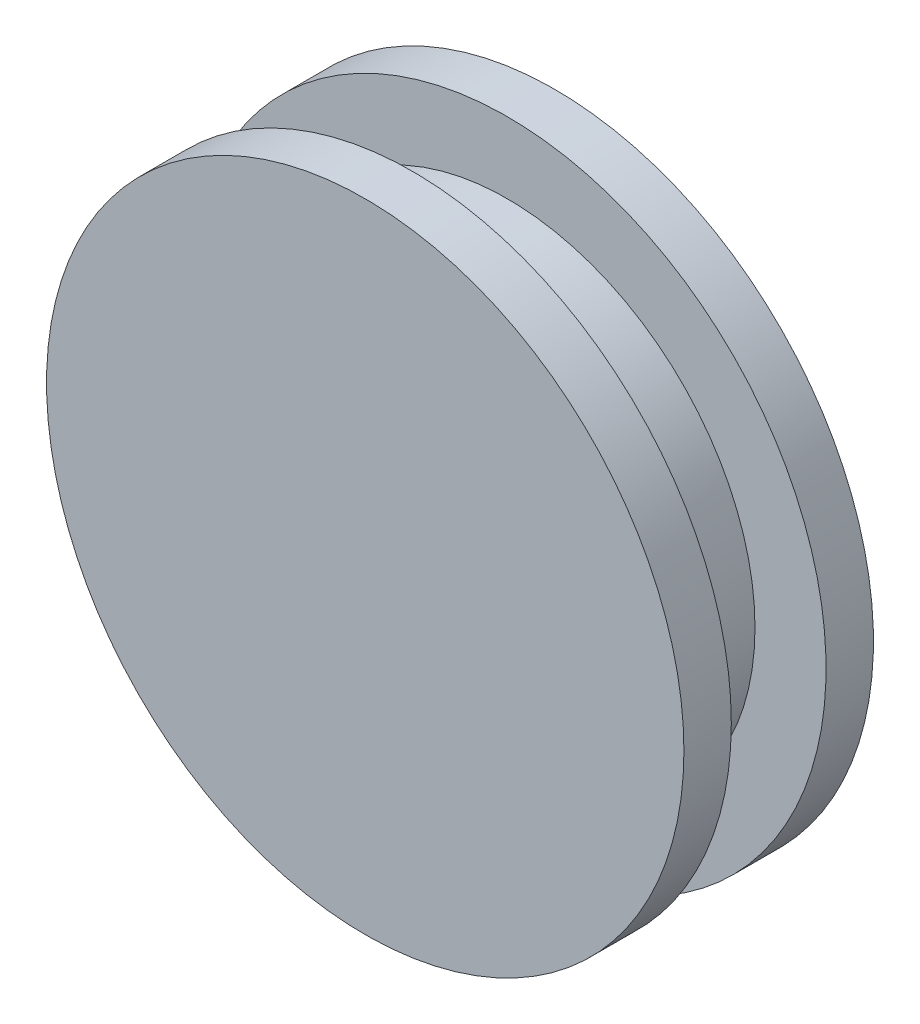
from build123d import *

# Parameters (mm, degrees)
SKETCH_1_R               = 5.226152672
SKETCH_1_R_2             = 4.375
EXTRUDE_1_DEPTH          = 4
EXTRUDE_2_DEPTH          = 4
PATTERN_CIRCULAR_1_COUNT = 15
SKETCH_6_R               = 6.726152672
EXTRUDE_3_DEPTH          = 1
EXTRUDE_START            = -1
SKETCH_7_R               = 6.726152672
EXTRUDE_4_DEPTH          = 1


with BuildPart() as part:
    # 草图1 → 凸台-拉伸1 (new body)
    with BuildSketch(Plane.XY):
        Circle(SKETCH_1_R)
        Circle(SKETCH_1_R_2, mode=Mode.SUBTRACT)
    extrude(amount=EXTRUDE_1_DEPTH)

    # 草图2 → 凸台-拉伸2 (add)
    with BuildSketch(Plane.XY):
        with BuildLine():
            ThreePointArc((0.31607031, 3.509643792), (0, 3.523847328), (-0.31607031, 3.509643792))
            add(Edge.make_bspline(
                [(-0.31607031, 3.509643792), (-0.317489514, 3.521081143), (-0.320420158, 3.535834937), (-0.324949459, 3.554314244), (-0.328034749, 3.565891921), (-0.331739755, 3.57876045), (-0.336117859, 3.59289901), (-0.341220963, 3.608285328), (-0.347100611, 3.624895512), (-0.353807588, 3.64270413), (-0.361391986, 3.661684207), (-0.369903132, 3.681807247), (-0.379389557, 3.703043255), (-0.389898951, 3.725360758), (-0.401478123, 3.748726822), (-0.414172969, 3.773107082), (-0.428028422, 3.79846576), (-0.443088427, 3.82476569), (-0.459395891, 3.851968348), (-0.476992655, 3.880033875), (-0.495919456, 3.908921106), (-0.516215888, 3.938587597), (-0.537920373, 3.968989654), (-0.561070121, 4.000082368), (-0.585701102, 4.031819639), (-0.61184801, 4.064154213), (-0.639544234, 4.097037714), (-0.668821825, 4.130420675), (-0.699711465, 4.164252574), (-0.732242442, 4.19848187), (-0.766442618, 4.233056038), (-0.802338402, 4.267921604), (-0.839954725, 4.303024185), (-0.879315006, 4.338308526), (-0.934862039, 4.38613503), (-0.978147055, 4.421171995), (-1.007818143, 4.444246795)],
                knots=[0, 0, 0, 0, 0.029141347, 0.03806468, 0.048177792, 0.05948068, 0.071973347, 0.085655791, 0.100528014, 0.116590013, 0.133841791, 0.152283346, 0.171914679, 0.19273579, 0.214746679, 0.237947345, 0.262337789, 0.287918011, 0.314688011, 0.342647788, 0.371797343, 0.402136676, 0.433665787, 0.466384675, 0.500293341, 0.535391785, 0.571680007, 0.609158006, 0.647825783, 0.687683338, 0.728730671, 0.770967781, 0.81439467, 0.859011336, 0.904817779, 1, 1, 1, 1], degree=3))
            ThreePointArc((-1.007818143, 4.444246795), (0, 4.557085361), (1.007818143, 4.444246795))
            add(Edge.make_bspline(
                [(0.31607031, 3.509643792), (0.317489514, 3.521081143), (0.320420158, 3.535834937), (0.324949459, 3.554314244), (0.328034749, 3.565891921), (0.331739755, 3.57876045), (0.336117859, 3.59289901), (0.341220963, 3.608285328), (0.347100611, 3.624895512), (0.353807588, 3.64270413), (0.361391986, 3.661684207), (0.369903132, 3.681807247), (0.379389557, 3.703043255), (0.389898951, 3.725360758), (0.401478123, 3.748726822), (0.414172969, 3.773107082), (0.428028422, 3.79846576), (0.443088427, 3.82476569), (0.459395891, 3.851968348), (0.476992655, 3.880033875), (0.495919456, 3.908921106), (0.516215888, 3.938587597), (0.537920373, 3.968989654), (0.561070121, 4.000082368), (0.585701102, 4.031819639), (0.61184801, 4.064154213), (0.639544234, 4.097037714), (0.668821825, 4.130420675), (0.699711465, 4.164252574), (0.732242442, 4.19848187), (0.766442618, 4.233056038), (0.802338402, 4.267921604), (0.839954725, 4.303024185), (0.879315006, 4.338308526), (0.934862039, 4.38613503), (0.978147055, 4.421171995), (1.007818143, 4.444246795)],
                knots=[0, 0, 0, 0, 0.029141347, 0.03806468, 0.048177792, 0.05948068, 0.071973347, 0.085655791, 0.100528014, 0.116590013, 0.133841791, 0.152283346, 0.171914679, 0.19273579, 0.214746679, 0.237947345, 0.262337789, 0.287918011, 0.314688011, 0.342647788, 0.371797343, 0.402136676, 0.433665787, 0.466384675, 0.500293341, 0.535391785, 0.571680007, 0.609158006, 0.647825783, 0.687683338, 0.728730671, 0.770967781, 0.81439467, 0.859011336, 0.904817779, 1, 1, 1, 1], degree=3))
        make_face()
    extrude_2 = extrude(amount=EXTRUDE_2_DEPTH)

    # 阵列(圆周)1: 凸台-拉伸2 ×15 about axis
    pattern_circular_1_axis = Axis((0, 0, 4), (0, 0, -1))
    for i in range(1, PATTERN_CIRCULAR_1_COUNT):
        add(extrude_2.rotate(pattern_circular_1_axis, i * 360 / PATTERN_CIRCULAR_1_COUNT))

    # 草图6 → 凸台-拉伸3 (add)
    with BuildSketch(Plane.XY.offset(4)):
        Circle(SKETCH_6_R)
    extrude(amount=-EXTRUDE_3_DEPTH)

    # 草图7 → 凸台-拉伸4 (add)
    with BuildSketch(Plane(origin=(0, 0, 0), x_dir=(-1, 0, 0), z_dir=(0, 0, -1)).offset(EXTRUDE_START)):
        Circle(SKETCH_7_R)
    extrude(amount=EXTRUDE_4_DEPTH)


solid = part.part
